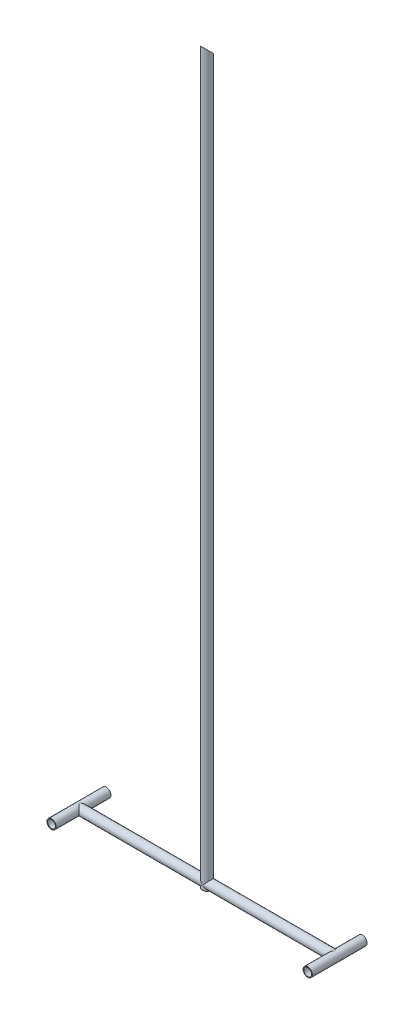
from build123d import *

# Parameters (mm, degrees)
SKETCH1_R                            = 12.7
SKETCH1_R_2                          = 10.7
EXTRUDE_THIN1_DEPTH                  = 2000
SKETCH6_R                            = 12.7
SKETCH6_R_2                          = 10.7
EXTRUDE_THIN4_DEPTH                  = 75
EXTRUDE_THIN5_REACH                  = 2086.148
EXTRUDE_THIN5_END_RADIUS             = 12.7
EXTRUDE_THIN5_START                  = 50
SKETCH7_R                            = 12.7
SKETCH7_R_2                          = 10.7
EXTRUDE_THIN5_DIRECTION_2_REACH      = 2086.148
EXTRUDE_THIN5_DIRECTION_2_END_RADIUS = 12.7
SKETCH8_R                            = 12.7
SKETCH8_R_2                          = 10.7
EXTRUDE_THIN6_DEPTH                  = 75
EXTRUDE_THIN8_REACH                  = 2086.148
EXTRUDE_THIN8_END_RADIUS             = 12.7
EXTRUDE_THIN8_START                  = -50
SKETCH9_R                            = 12.7
SKETCH9_R_2                          = 10.7
EXTRUDE_THIN8_DIRECTION_2_REACH      = 2086.148
EXTRUDE_THIN8_DIRECTION_2_END_RADIUS = 12.7


with BuildPart() as part:
    # Sketch1 → Extrude-Thin1 (new body)
    with BuildSketch(Plane(origin=(0, 0, 0), x_dir=(1, 0, 0), z_dir=(0, 1, 0))):
        Circle(SKETCH1_R)
        Circle(SKETCH1_R_2, mode=Mode.SUBTRACT)
    extrude(amount=EXTRUDE_THIN1_DEPTH)



with BuildPart() as body_2:
    # Sketch6 → Extrude-Thin4 (new, symmetric)
    with BuildSketch(Plane.XY):
        with Locations((350.8, 12.7)):
            Circle(SKETCH6_R)
        with Locations((350.8, 12.7)):
            Circle(SKETCH6_R_2, mode=Mode.SUBTRACT)
    extrude(amount=EXTRUDE_THIN4_DEPTH, both=True)


with BuildPart() as part_1:
    add(part.part)

    add(body_2.part)  # Extrude-Thin5 merges body 2
    # Extrude-Thin5: up to this cylinder (the profile starts outside it)
    extrude_thin5_end = Plane(origin=(350.8, 12.7, 12.34079), z_dir=(0, 0, -1)) * Cylinder(EXTRUDE_THIN5_END_RADIUS, 4198.696, mode=Mode.PRIVATE)
    # Sketch7 → Extrude-Thin5 (add, up to the surface)
    with BuildSketch(Plane(origin=(0, 0, 0), x_dir=(0, 0, -1), z_dir=(1, 0, 0)).offset(EXTRUDE_THIN5_START), mode=Mode.PRIVATE) as extrude_thin5_sk1:
        with Locations((0, 12.7)):
            Circle(SKETCH7_R)
        with Locations((0, 12.7)):
            Circle(SKETCH7_R_2, mode=Mode.SUBTRACT)
    extrude_thin5_tool1 = extrude(extrude_thin5_sk1.sketch, amount=EXTRUDE_THIN5_REACH, mode=Mode.PRIVATE) - extrude_thin5_end
    add(extrude_thin5_tool1.solids().sort_by_distance((50, 12.7, 12.34079))[0])

    # Extrude-Thin5 direction 2: up to this cylinder (the profile starts outside it)
    extrude_thin5_direction_2_end = Plane(origin=(0, 12.7, 0), z_dir=(0, -1, 0)) * Cylinder(EXTRUDE_THIN5_DIRECTION_2_END_RADIUS, 4198.696, mode=Mode.PRIVATE)
    # Sketch7 → Extrude-Thin5 direction 2 (add, up to the surface)
    with BuildSketch(Plane(origin=(0, 0, 0), x_dir=(0, 0, -1), z_dir=(1, 0, 0)).offset(EXTRUDE_THIN5_START), mode=Mode.PRIVATE) as extrude_thin5_direction_2_sk1:
        with Locations((0, 12.7)):
            Circle(SKETCH7_R)
        with Locations((0, 12.7)):
            Circle(SKETCH7_R_2, mode=Mode.SUBTRACT)
    extrude_thin5_direction_2_tool1 = extrude(extrude_thin5_direction_2_sk1.sketch, amount=-EXTRUDE_THIN5_DIRECTION_2_REACH, mode=Mode.PRIVATE) - extrude_thin5_direction_2_end
    add(extrude_thin5_direction_2_tool1.solids().sort_by_distance((50, 12.7, 12.34079))[0])



with BuildPart() as body_2_2:
    # Sketch8 → Extrude-Thin6 (new, symmetric)
    with BuildSketch(Plane.XY):
        with Locations((-350.8, 12.7)):
            Circle(SKETCH8_R)
        with Locations((-350.8, 12.7)):
            Circle(SKETCH8_R_2, mode=Mode.SUBTRACT)
    extrude(amount=EXTRUDE_THIN6_DEPTH, both=True)


with BuildPart() as part_2:
    add(part_1.part)

    add(body_2_2.part)  # Extrude-Thin8 merges body 2 2
    # Extrude-Thin8: up to this cylinder (the profile starts outside it)
    extrude_thin8_end = Plane(origin=(-350.8, 12.7, 12.34079), z_dir=(0, 0, -1)) * Cylinder(EXTRUDE_THIN8_END_RADIUS, 4198.696, mode=Mode.PRIVATE)
    # Sketch9 → Extrude-Thin8 (add, up to the surface)
    with BuildSketch(Plane(origin=(0, 0, 0), x_dir=(0, 0, -1), z_dir=(1, 0, 0)).offset(EXTRUDE_THIN8_START), mode=Mode.PRIVATE) as extrude_thin8_sk1:
        with Locations((0, 12.7)):
            Circle(SKETCH9_R)
        with Locations((0, 12.7)):
            Circle(SKETCH9_R_2, mode=Mode.SUBTRACT)
    extrude_thin8_tool1 = extrude(extrude_thin8_sk1.sketch, amount=-EXTRUDE_THIN8_REACH, mode=Mode.PRIVATE) - extrude_thin8_end
    add(extrude_thin8_tool1.solids().sort_by_distance((-50, 12.7, 12.34079))[0])

    # Extrude-Thin8 direction 2: up to this cylinder (the profile starts outside it)
    extrude_thin8_direction_2_end = Plane(origin=(0, 12.7, 0), z_dir=(0, -1, 0)) * Cylinder(EXTRUDE_THIN8_DIRECTION_2_END_RADIUS, 4198.696, mode=Mode.PRIVATE)
    # Sketch9 → Extrude-Thin8 direction 2 (add, up to the surface)
    with BuildSketch(Plane(origin=(0, 0, 0), x_dir=(0, 0, -1), z_dir=(1, 0, 0)).offset(EXTRUDE_THIN8_START), mode=Mode.PRIVATE) as extrude_thin8_direction_2_sk1:
        with Locations((0, 12.7)):
            Circle(SKETCH9_R)
        with Locations((0, 12.7)):
            Circle(SKETCH9_R_2, mode=Mode.SUBTRACT)
    extrude_thin8_direction_2_tool1 = extrude(extrude_thin8_direction_2_sk1.sketch, amount=EXTRUDE_THIN8_DIRECTION_2_REACH, mode=Mode.PRIVATE) - extrude_thin8_direction_2_end
    add(extrude_thin8_direction_2_tool1.solids().sort_by_distance((-50, 12.7, 12.34079))[0])

    # SurfaceCut1
    split(bisect_by=Plane(origin=(0, 993.65, -993.65), x_dir=(0, -0.7071067811865457, -0.7071067811865493), z_dir=(0, -0.7071067811865493, 0.7071067811865457)), keep=Keep.TOP)


solid = part_2.part
